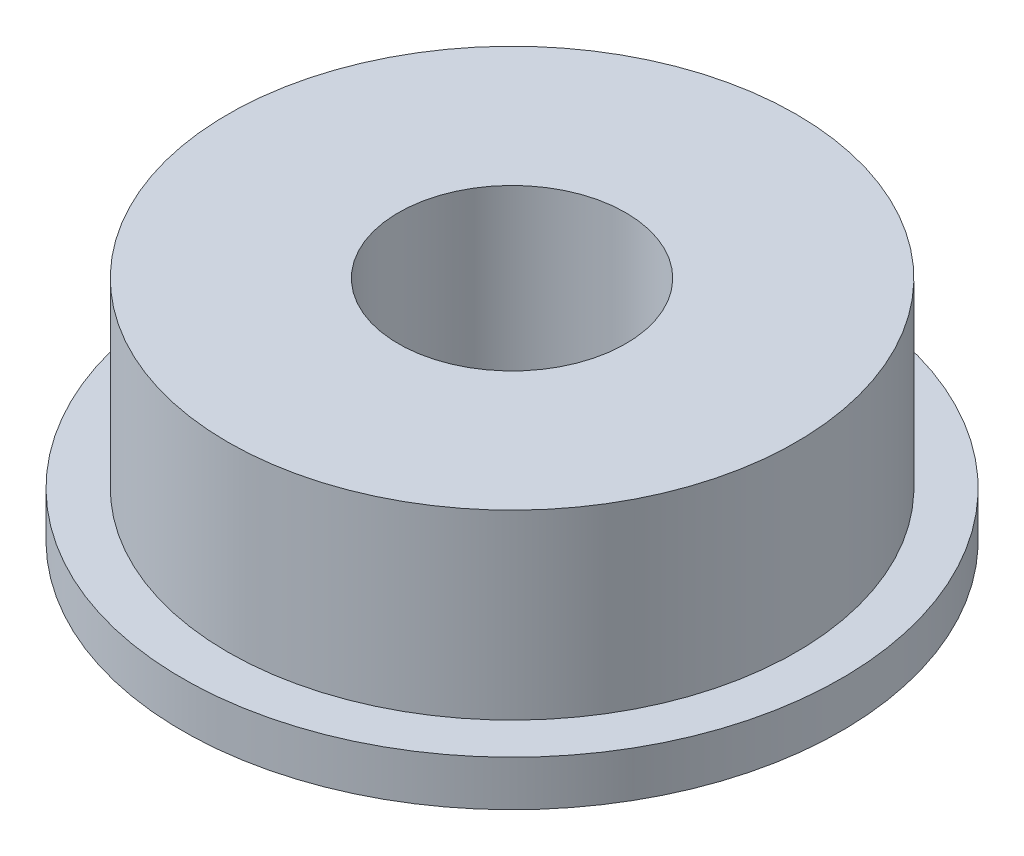
from build123d import *


with BuildPart() as part:
    # 草图1 → 旋转1 (revolve)
    with BuildSketch(Plane.XY, mode=Mode.PRIVATE) as revolve_1_sk:
        Polygon((2, 4), (2, 0), (5.8, 0), (5.8, 0.8), (5, 0.8), (5, 4), align=None)
    revolve(revolve_1_sk.sketch.rotate(Axis((0, 0, 0), (0, 1, 0)), 90), axis=Axis((0, 0, 0), (0, 1, 0)))


solid = part.part
